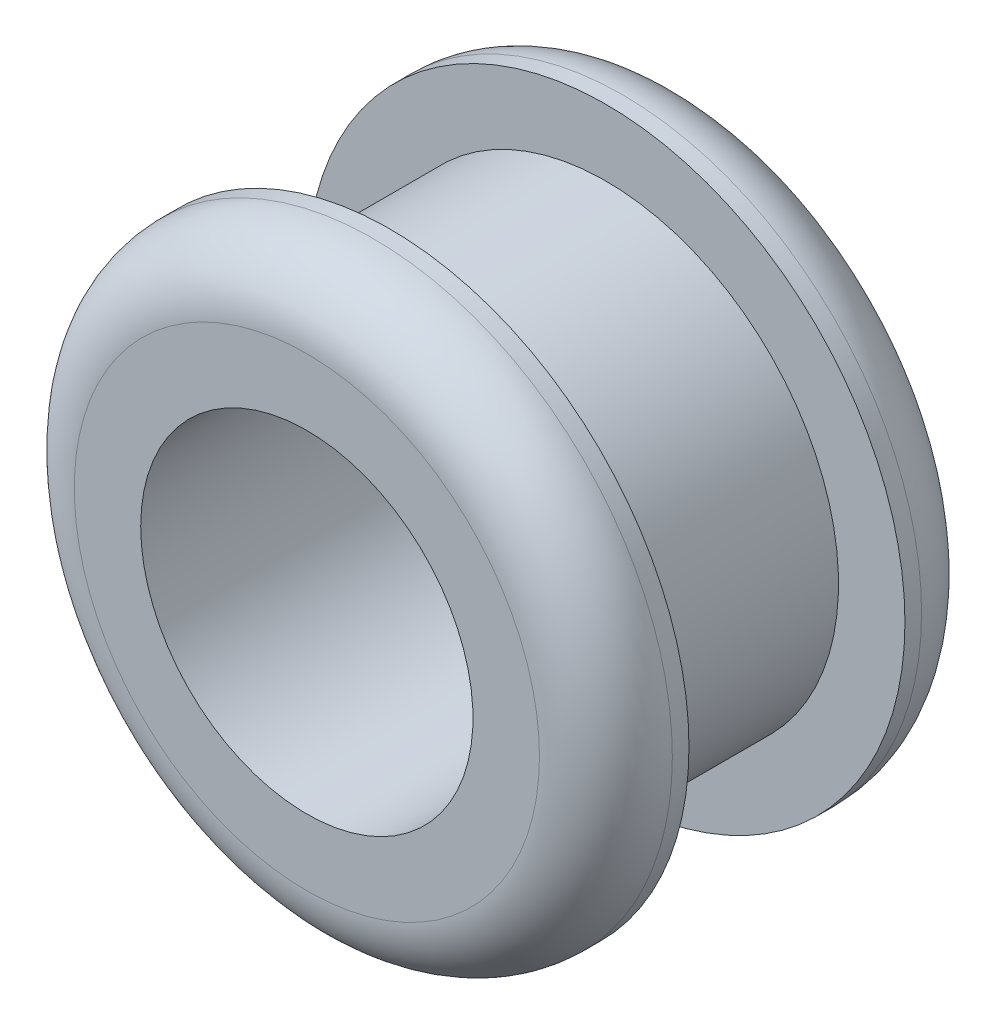
from build123d import *

# Parameters (mm, degrees)
SKETCH1_R            = 7
SKETCH1_R_2          = 5
BOSS_EXTRUDE1_DEPTH  = 3.25
SKETCH2_R            = 9
SKETCH2_R_2          = 5
BOSS_EXTRUDE2_DEPTH  = 2.5
FILLET1_R            = 2
FILLET1_OF_MIRROR1_R = 2


with BuildPart() as part:
    # Sketch1 → Boss-Extrude1 (new, symmetric)
    with BuildSketch(Plane.XY):
        with Locations(Location((0, 0, 0), (0, 0, 180))):
            Circle(SKETCH1_R)
        with Locations(Location((0, 0, 0), (0, 0, 180))):
            Circle(SKETCH1_R_2, mode=Mode.SUBTRACT)
    extrude(amount=BOSS_EXTRUDE1_DEPTH, both=True)

    # Sketch2 → Boss-Extrude2 (add)
    with BuildSketch(Plane.XY.offset(3.25)):
        Circle(SKETCH2_R)
        with Locations(Location((0, 0, 0), (0, 0, 180))):
            Circle(SKETCH2_R_2, mode=Mode.SUBTRACT)
    boss_extrude2 = extrude(amount=BOSS_EXTRUDE2_DEPTH)

    # Fillet1
    fillet1_edges = [part.edges().sort_by_distance(p)[0] for p in [
        (-9, 0, 5.75),
    ]]
    fillet(fillet1_edges, radius=FILLET1_R)

    # Mirror1: Boss-Extrude2 across plane
    add(boss_extrude2.mirror(Plane.XY))

    # Fillet1 of Mirror1
    fillet1_of_mirror1_edges = [part.edges().sort_by_distance(p)[0] for p in [
        (-9, 0, -5.75),
    ]]
    fillet(fillet1_of_mirror1_edges, radius=FILLET1_OF_MIRROR1_R)


solid = part.part
